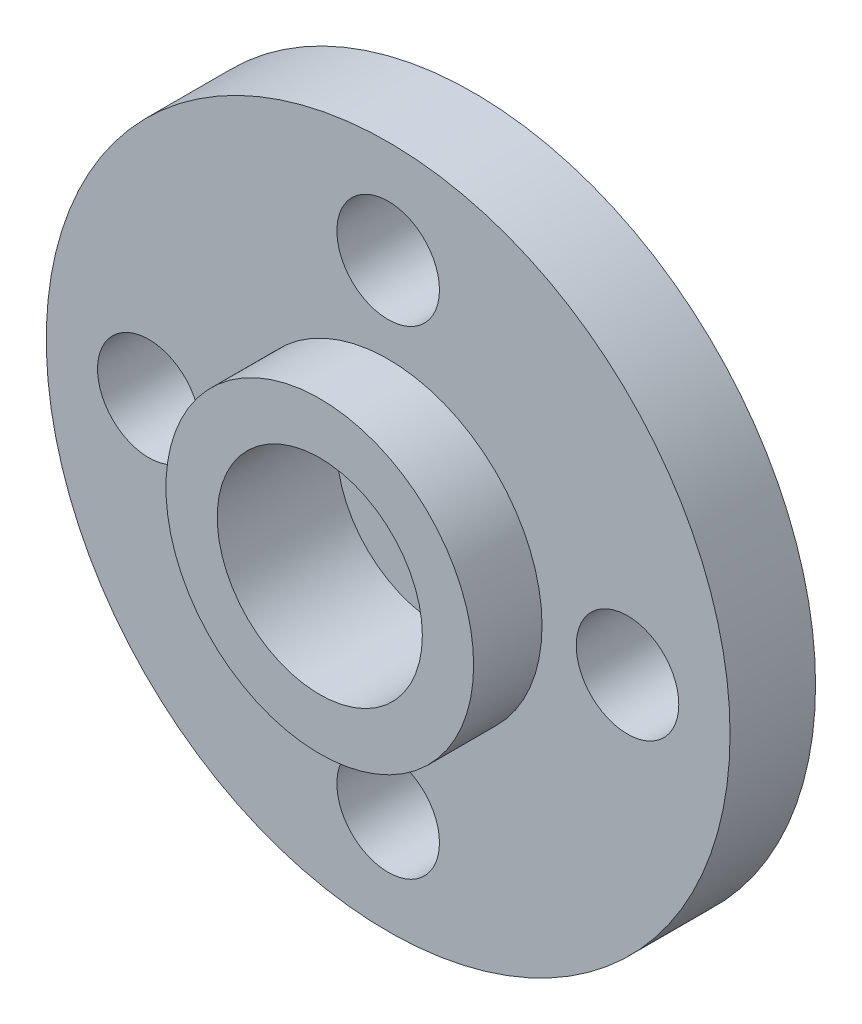
from build123d import *

# Parameters (mm, degrees)
SKETCH1_R             = 10
EXTRUDE_355_DEPTH     = 2.5
SKETCH2_R             = 4.5
SKETCH2_R_2           = 3
EXTRUDE_469_DEPTH     = 2
SKETCH3_R             = 1.5
CUT_EXTRUDE_563_DEPTH = 13
SKETCH4_R             = 1.5
CUT_EXTRUDE_792_DEPTH = 13
CUT_EXTRUDE_START     = -3.5
SKETCH5_R             = 3
CUT_EXTRUDE_901_DEPTH = 3.5


with BuildPart() as part:
    # Sketch1 → Extrude 355 (new body)
    with BuildSketch(Plane.XY):
        Circle(SKETCH1_R)
    extrude(amount=EXTRUDE_355_DEPTH)

    # Sketch2 → Extrude 469 (add)
    with BuildSketch(Plane.XY.offset(2.5)):
        Circle(SKETCH2_R)
        Circle(SKETCH2_R_2, mode=Mode.SUBTRACT)
    extrude(amount=EXTRUDE_469_DEPTH)

    # Sketch3 → Cut-Extrude 563 (cut)
    with BuildSketch(Plane.XY.offset(2.5)):
        Circle(SKETCH3_R)
    extrude(amount=-CUT_EXTRUDE_563_DEPTH, mode=Mode.SUBTRACT)

    # Sketch4 → Cut-Extrude 792 (cut)
    with BuildSketch(Plane.XY.offset(2.5)):
        with Locations((0, 7)):
            Circle(SKETCH4_R)
        with Locations((7, 0)):
            Circle(SKETCH4_R)
        with Locations((0, -7)):
            Circle(SKETCH4_R)
        with Locations((-7, 0)):
            Circle(SKETCH4_R)
    extrude(amount=-CUT_EXTRUDE_792_DEPTH, mode=Mode.SUBTRACT)

    # Sketch5 → Cut-Extrude 901 (cut)
    with BuildSketch(Plane.XY.offset(4.5).offset(CUT_EXTRUDE_START)):
        Circle(SKETCH5_R)
    extrude(amount=CUT_EXTRUDE_901_DEPTH, mode=Mode.SUBTRACT)


solid = part.part
